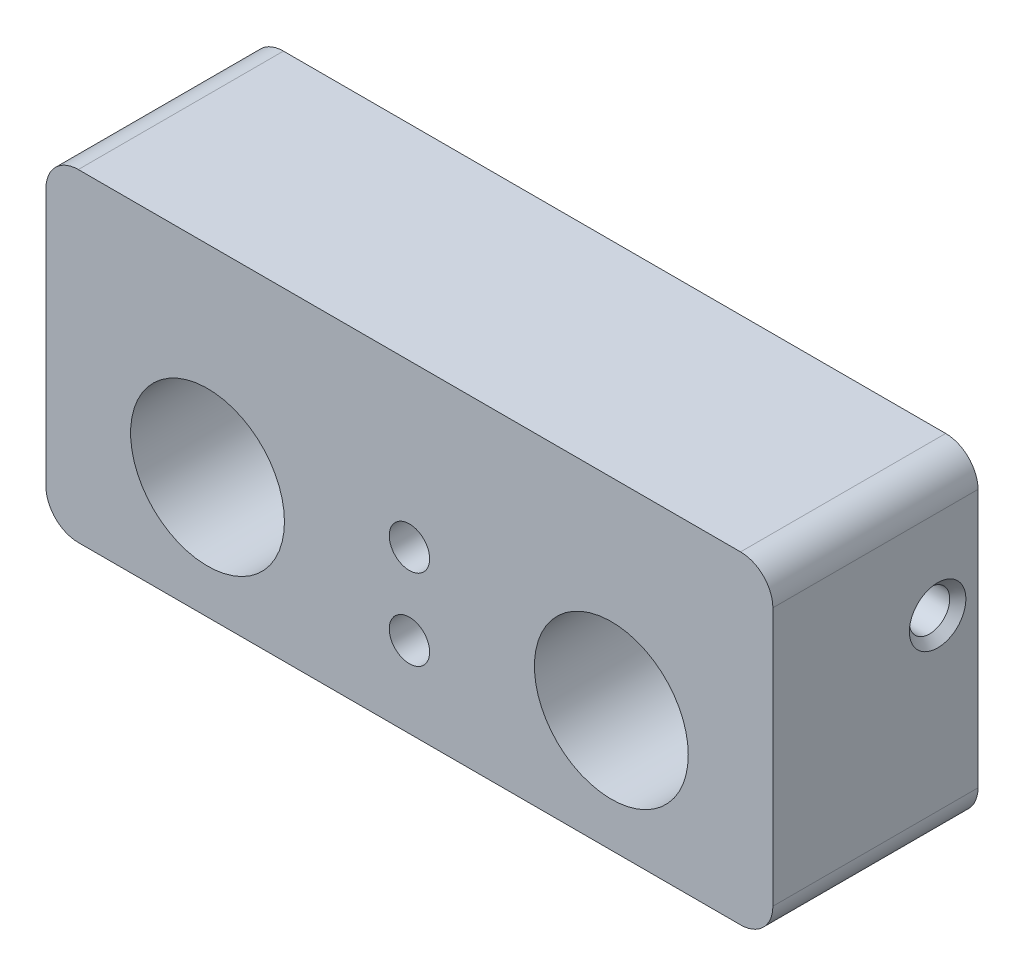
from build123d import *

# Parameters (mm, degrees)
SKETCH1_W                       = 45
SKETCH1_H                       = 20
SKETCH1_R                       = 4.7625
BOSS_EXTRUDE1_DEPTH             = 12.7
TAP_DRILL_FOR_M3X0_5_TAP1_D     = 2.5
TAP_DRILL_FOR_M3X0_5_TAP1_DEPTH = 10
TAP_DRILL_FOR_M3X0_5_TAP1_TIP   = 0.751075774
FILLET1_R                       = 2
CHAMFER1_SIZE                   = 0.5


with BuildPart() as part:
    # Sketch1 → Boss-Extrude1 (new body)
    with BuildSketch(Plane.XY):
        with Locations((5.818965517, -6.284482759)):
            Rectangle(SKETCH1_W, SKETCH1_H)
        with Locations((-6.681034483, -8.784482759)):
            Circle(SKETCH1_R, mode=Mode.SUBTRACT)
        with Locations((18.318965517, -8.784482759)):
            Circle(SKETCH1_R, mode=Mode.SUBTRACT)
    extrude(amount=BOSS_EXTRUDE1_DEPTH)

    # Tap Drill for M3x0.5 Tap1
    with Locations(Plane.XY.offset(12.7)):
        with Locations((5.818965517, -6.284482759), (5.818965517, -11.284482759)):
            Hole(TAP_DRILL_FOR_M3X0_5_TAP1_D / 2, depth=TAP_DRILL_FOR_M3X0_5_TAP1_DEPTH)
            with Locations((0, 0, -(TAP_DRILL_FOR_M3X0_5_TAP1_DEPTH + TAP_DRILL_FOR_M3X0_5_TAP1_TIP / 2))):  # 118° drill point
                Cone(0, TAP_DRILL_FOR_M3X0_5_TAP1_D / 2, TAP_DRILL_FOR_M3X0_5_TAP1_TIP, mode=Mode.SUBTRACT)

    # Fillet1
    fillet1_edges = [part.edges().sort_by_distance(p)[0] for p in [
        (-16.681034483, 3.715517241, 6.35),
        (28.318965517, 3.715517241, 6.35),
        (28.318965517, -16.284482759, 6.35),
        (-16.681034483, -16.284482759, 6.35),
    ]]
    fillet(fillet1_edges, radius=FILLET1_R)

    # Sketch8 → Tap Drill for M3x0.5 Tap2 (revolve, cut)
    with BuildSketch(Plane(origin=(-16.681034483, -3.784482759, 2.5), x_dir=(0, 0, 1), z_dir=(0, 1, 0))):
        Polygon((0, 0), (0, 5.751075774), (1.25, 5), (1.25, 0), align=None)
    tap_drill_for_m3x0_5_tap2 = revolve(axis=Axis((-23.031034483, -3.784482759, 2.5), (1, 0, 0)), mode=Mode.SUBTRACT)

    # Mirror3: Tap Drill for M3x0.5 Tap2 across plane
    add(tap_drill_for_m3x0_5_tap2.mirror(Plane(origin=(5.818965517, 0, 0), x_dir=(0, 0, 1), z_dir=(1, 0, 0))), mode=Mode.SUBTRACT)

    # Chamfer1
    chamfer1_edges = [part.edges().sort_by_distance(p)[0] for p in [
        (-16.681034483, -3.784482759, 1.25),
        (28.318965517, -3.784482759, 1.25),
    ]]
    chamfer(chamfer1_edges, length=CHAMFER1_SIZE)


solid = part.part
